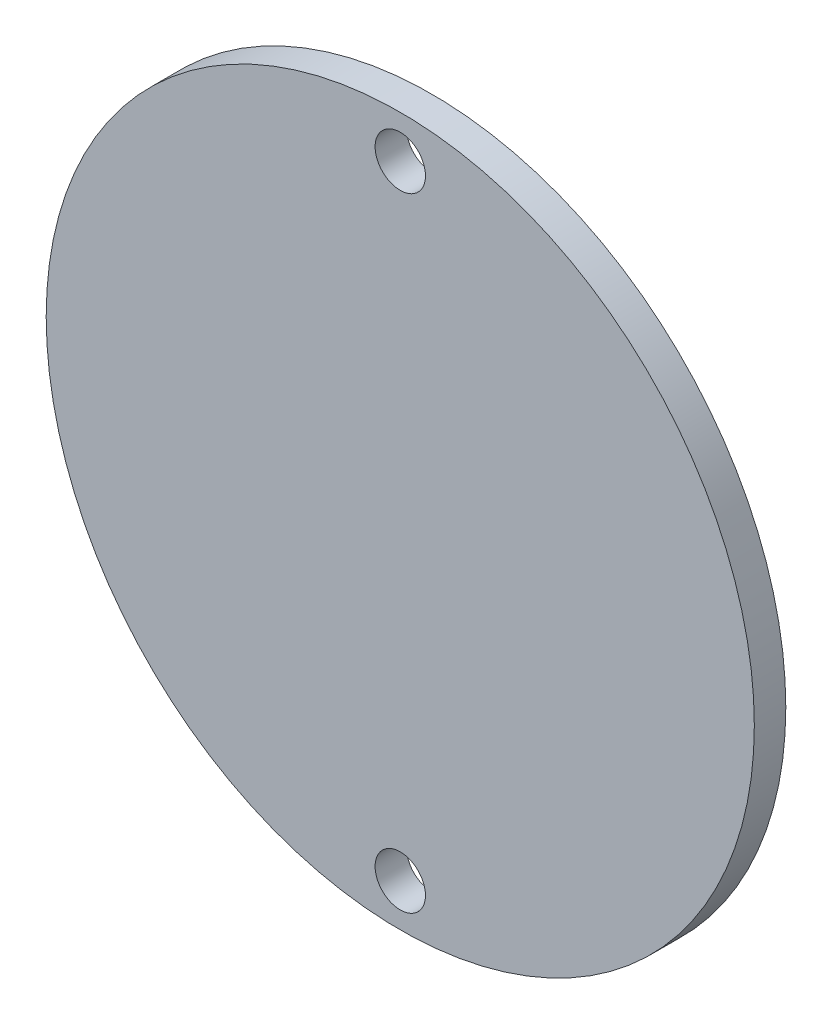
from build123d import *

# Parameters (mm, degrees)
SKETCH_1_R      = 22.5
SKETCH_1_R_2    = 1.6
EXTRUDE_1_DEPTH = 2


with BuildPart() as part:
    # 草图1 → 凸台-拉伸1 (new body)
    with BuildSketch(Plane.XY):
        Circle(SKETCH_1_R)
        with Locations((0, 19.8)):
            Circle(SKETCH_1_R_2, mode=Mode.SUBTRACT)
        with Locations((0, -19.8)):
            Circle(SKETCH_1_R_2, mode=Mode.SUBTRACT)
    extrude(amount=EXTRUDE_1_DEPTH)


solid = part.part
